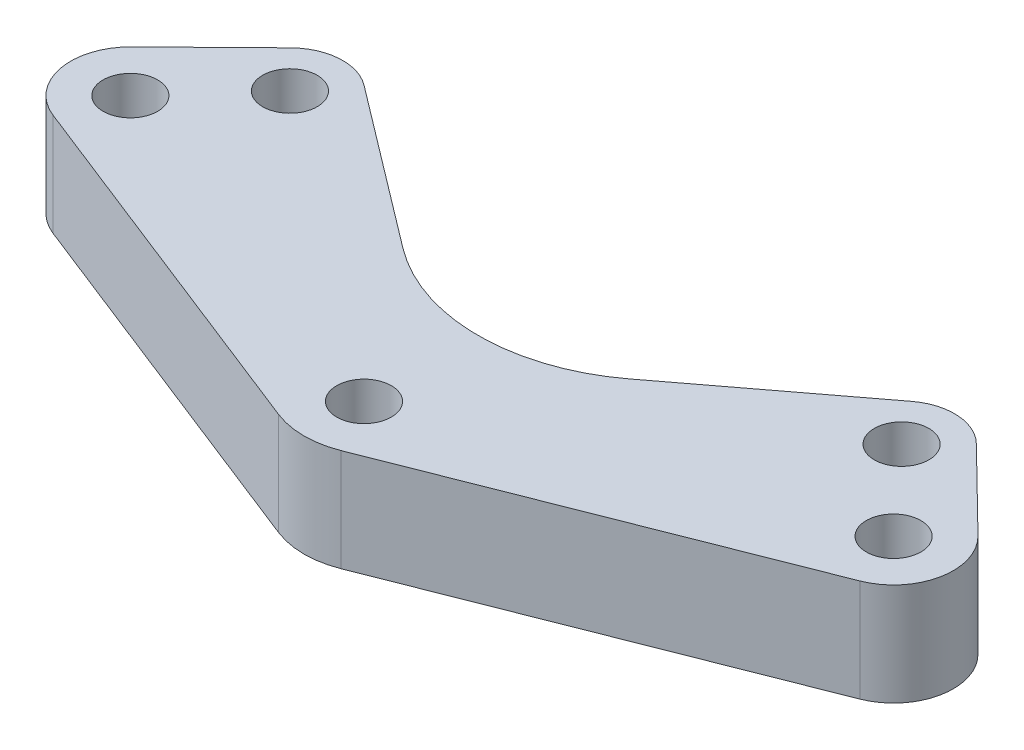
from build123d import *

# Parameters (mm, degrees)
ESBO_O1_R                = 1.6
RESSALTO_EXTRUS_O1_DEPTH = 6


with BuildPart() as part:
    # Esboço1 → Ressalto-extrusão1 (new body)
    with BuildSketch(Plane.XZ.offset(6)):
        with BuildLine():
            Line((23.658239146, -5.419790473), (1.830835365, 3.169198905))
            ThreePointArc((1.830835365, 3.169198905), (0, 3.516453278), (-1.830835365, 3.169198905))
            Line((-1.830835365, 3.169198905), (-23.658239146, -5.419790473))
            ThreePointArc((-23.658239146, -5.419790473), (-25.806836409, -7.98111819), (-24.825744035, -11.177104364))
            Line((-24.825744035, -11.177104364), (-20.101514858, -15.804403192))
            ThreePointArc((-20.101514858, -15.804403192), (-18.128320556, -16.683568025), (-16.059952818, -16.060445681))
            Line((-16.059952818, -16.060445681), (-6.643887712, -8.924606384))
            ThreePointArc((-6.643887712, -8.924606384), (0, -6.691518958), (6.643887712, -8.924606384))
            Line((6.643887712, -8.924606384), (16.059952818, -16.060445681))
            ThreePointArc((16.059952818, -16.060445681), (18.128320556, -16.683568025), (20.101514858, -15.804403192))
            Line((20.101514858, -15.804403192), (24.825744035, -11.177104364))
            ThreePointArc((24.825744035, -11.177104364), (25.806836409, -7.98111819), (23.658239146, -5.419790473))
        make_face()
        with Locations(Location((-17.932321173, -13.589770319, 0), (0, 0, 90))):
            Circle(ESBO_O1_R, mode=Mode.SUBTRACT)
        with Locations(Location((0, 0, 0), (0, 0, 90))):
            Circle(ESBO_O1_R, mode=Mode.SUBTRACT)
        with Locations(Location((17.932321173, -13.589770319, 0), (0, 0, 90))):
            Circle(ESBO_O1_R, mode=Mode.SUBTRACT)
        with Locations(Location((-22.376654391, -8.676712411, 0), (0, 0, 90))):
            Circle(ESBO_O1_R, mode=Mode.SUBTRACT)
        with Locations(Location((22.376654391, -8.676712411, 0), (0, 0, 90))):
            Circle(ESBO_O1_R, mode=Mode.SUBTRACT)
    extrude(amount=-RESSALTO_EXTRUS_O1_DEPTH)


solid = part.part
